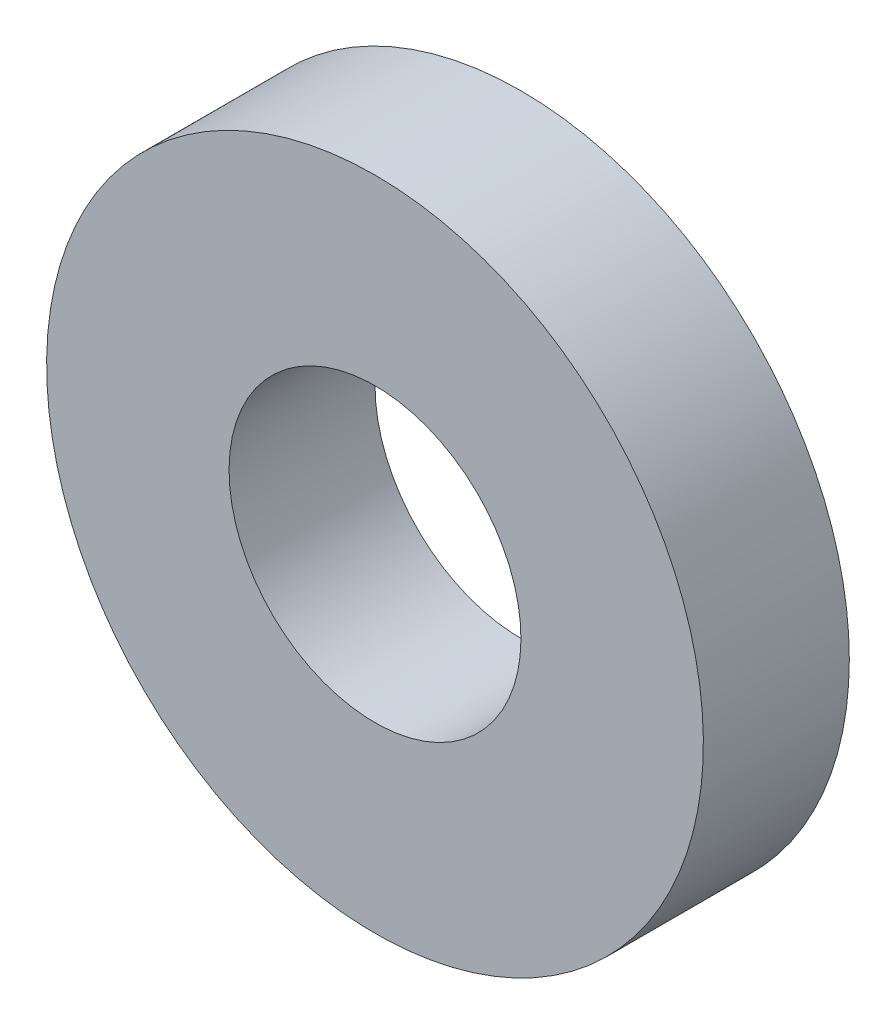
from build123d import *

# Parameters (mm, degrees)
SKETCH1_R           = 9
SKETCH1_R_2         = 4
BOSS_EXTRUDE1_DEPTH = 4


with BuildPart() as part:
    # Sketch1 → Boss-Extrude1 (new body)
    with BuildSketch(Plane.XY):
        with Locations(Location((0, 0, 0), (0, 0, 90))):
            Circle(SKETCH1_R)
        with Locations(Location((0, 0, 0), (0, 0, 266.674011469))):
            Circle(SKETCH1_R_2, mode=Mode.SUBTRACT)
    extrude(amount=BOSS_EXTRUDE1_DEPTH)


solid = part.part
